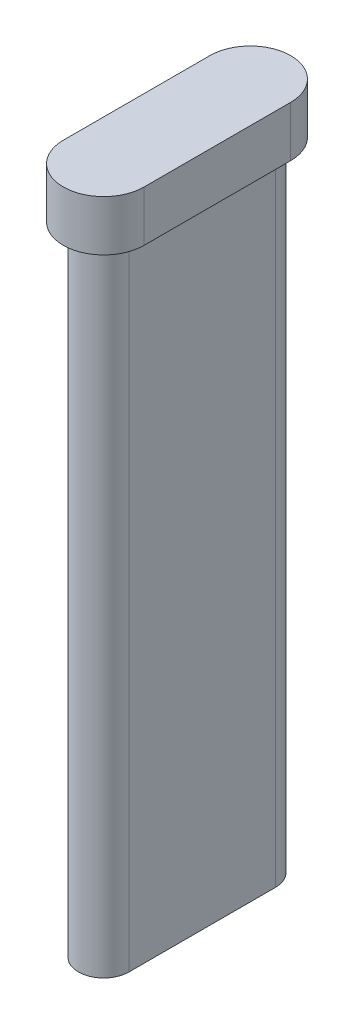
from build123d import *

# Parameters (mm, degrees)
BOSS_EXTRUDE1_DEPTH = 68
BOSS_EXTRUDE2_DEPTH = 5


with BuildPart() as part:
    # Sketch1 → Boss-Extrude1 (new body)
    with BuildSketch(Plane(origin=(0, 0, 0), x_dir=(1, 0, 0), z_dir=(0, 1, 0))):
        with BuildLine():
            Line((-2.5, -7.25), (-2.5, 7.25))
            ThreePointArc((-2.5, 7.25), (0, 9.75), (2.5, 7.25))
            Line((2.5, 7.25), (2.5, -7.25))
            ThreePointArc((2.5, -7.25), (0, -9.75), (-2.5, -7.25))
        make_face()
    extrude(amount=-BOSS_EXTRUDE1_DEPTH)

    # Sketch2 → Boss-Extrude2 (add)
    with BuildSketch(Plane(origin=(0, 0, 0), x_dir=(1, 0, 0), z_dir=(0, 1, 0))):
        with BuildLine():
            Line((4, -7.25), (4, 7.25))
            ThreePointArc((4, 7.25), (0, 11.25), (-4, 7.25))
            Line((-4, 7.25), (-4, -7.25))
            ThreePointArc((-4, -7.25), (0, -11.25), (4, -7.25))
        make_face()
    extrude(amount=-BOSS_EXTRUDE2_DEPTH)


solid = part.part
